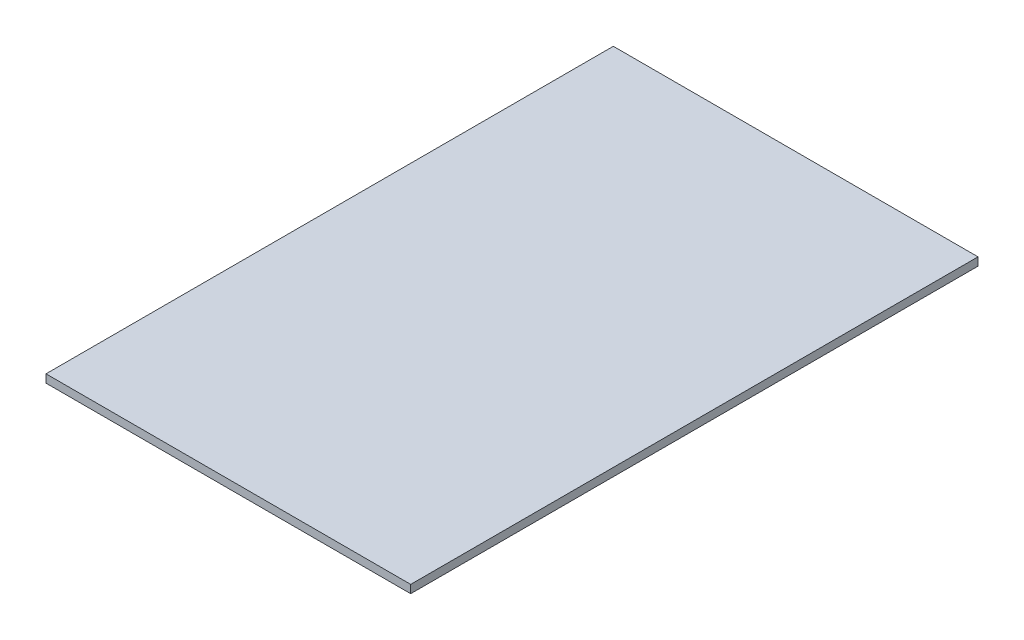
from build123d import *

# Parameters (mm, degrees)
SKETCH1_W           = 285.75
SKETCH1_H           = 444.5
BOSS_EXTRUDE1_DEPTH = 3.175


with BuildPart() as part:
    # Sketch1 → Boss-Extrude1 (new, symmetric)
    with BuildSketch(Plane(origin=(0, 0, 0), x_dir=(1, 0, 0), z_dir=(0, 1, 0))):
        Rectangle(SKETCH1_W, SKETCH1_H)
    extrude(amount=BOSS_EXTRUDE1_DEPTH, both=True)


solid = part.part
